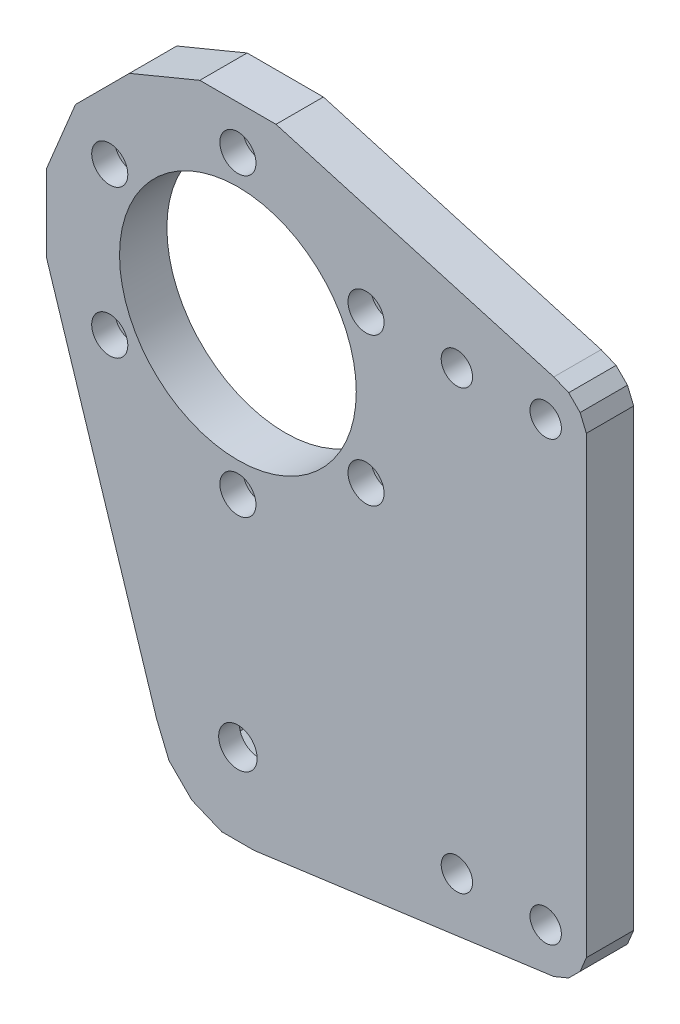
from build123d import *

# Parameters (mm, degrees)
FRAME_AND_BENCH_INTERFACE_START = -1
PROFILE_1_R                     = 20
PROFILE_1_R_2                   = 3.25
PROFILE_1_R_3                   = 1.65
PROFILE_1_R_4                   = 2.65
FRAME_AND_BENCH_INTERFACE_DEPTH = 8
RECESS_STATOR_SCREW_HEADS_START = 3.1
PROFILE_2_R                     = 3.05
RECESS_STATOR_SCREW_HEADS_DEPTH = 4
REAR_CAPTIVE_NUT_B_START        = -1.01
REAR_CAPTIVE_NUT_B_DEPTH        = 4.51


with BuildPart() as part:
    # Profile_1 → Frame_and_bench_interface (new body)
    with BuildSketch(Plane.XY.offset(FRAME_AND_BENCH_INTERFACE_START)):
        Polygon((57.820287286, 15.888991631), (55.888991631, 17.820287286), (53.365632254, 18.865496963), (6.437980627, 32.365914253), (-6.437980627, 32.365914253), (-18.33381769, 27.438497206), (-27.438497206, 18.33381769), (-32.365914253, 6.437980627), (-32.365914253, -6.437980627), (-13.730993926, -64.731264508), (-11.640574572, -69.777983262), (-7.777983262, -73.640574572), (-2.731264508, -75.730993926), (2.731264508, -75.730993926), (53.365632254, -68.865496963), (55.888991631, -67.820287286), (57.820287286, -65.888991631), (58.865496963, -63.365632254), (58.865496963, 13.365632254), align=None)
        Circle(PROFILE_1_R, mode=Mode.SUBTRACT)
        with Locations((0, -62)):
            Circle(PROFILE_1_R_2, mode=Mode.SUBTRACT)
        with Locations((-21.650635095, 12.5)):
            Circle(PROFILE_1_R_3, mode=Mode.SUBTRACT)
        with Locations((0, 25)):
            Circle(PROFILE_1_R_3, mode=Mode.SUBTRACT)
        with Locations((21.650635095, 12.5)):
            Circle(PROFILE_1_R_3, mode=Mode.SUBTRACT)
        with Locations((21.650635095, -12.5)):
            Circle(PROFILE_1_R_3, mode=Mode.SUBTRACT)
        with Locations((0, -25)):
            Circle(PROFILE_1_R_3, mode=Mode.SUBTRACT)
        with Locations((-21.650635095, -12.5)):
            Circle(PROFILE_1_R_3, mode=Mode.SUBTRACT)
        with Locations((52, 12)):
            Circle(PROFILE_1_R_4, mode=Mode.SUBTRACT)
        with Locations((37, 12)):
            Circle(PROFILE_1_R_4, mode=Mode.SUBTRACT)
        with Locations((52, -62)):
            Circle(PROFILE_1_R_4, mode=Mode.SUBTRACT)
        with Locations((37, -62)):
            Circle(PROFILE_1_R_4, mode=Mode.SUBTRACT)
    extrude(amount=FRAME_AND_BENCH_INTERFACE_DEPTH)

    # Profile_2 → Recess_stator_screw_heads (cut)
    with BuildSketch(Plane.XY.offset(RECESS_STATOR_SCREW_HEADS_START)):
        with Locations((-21.650635095, 12.5)):
            Circle(PROFILE_2_R)
        with Locations((0, 25)):
            Circle(PROFILE_2_R)
        with Locations((21.650635095, 12.5)):
            Circle(PROFILE_2_R)
        with Locations((21.650635095, -12.5)):
            Circle(PROFILE_2_R)
        with Locations((0, -25)):
            Circle(PROFILE_2_R)
        with Locations((-21.650635095, -12.5)):
            Circle(PROFILE_2_R)
    extrude(amount=RECESS_STATOR_SCREW_HEADS_DEPTH, mode=Mode.SUBTRACT)

    # Profile_3 → Rear_captive_nut_B (cut)
    with BuildSketch(Plane.XY.offset(REAR_CAPTIVE_NUT_B_START)):
        Polygon((-5.175, -64.987787643), (0, -67.975575286), (5.175, -64.987787643), (5.175, -59.012212357), (0, -56.024424714), (-5.175, -59.012212357), align=None)
    extrude(amount=REAR_CAPTIVE_NUT_B_DEPTH, mode=Mode.SUBTRACT)


solid = part.part
